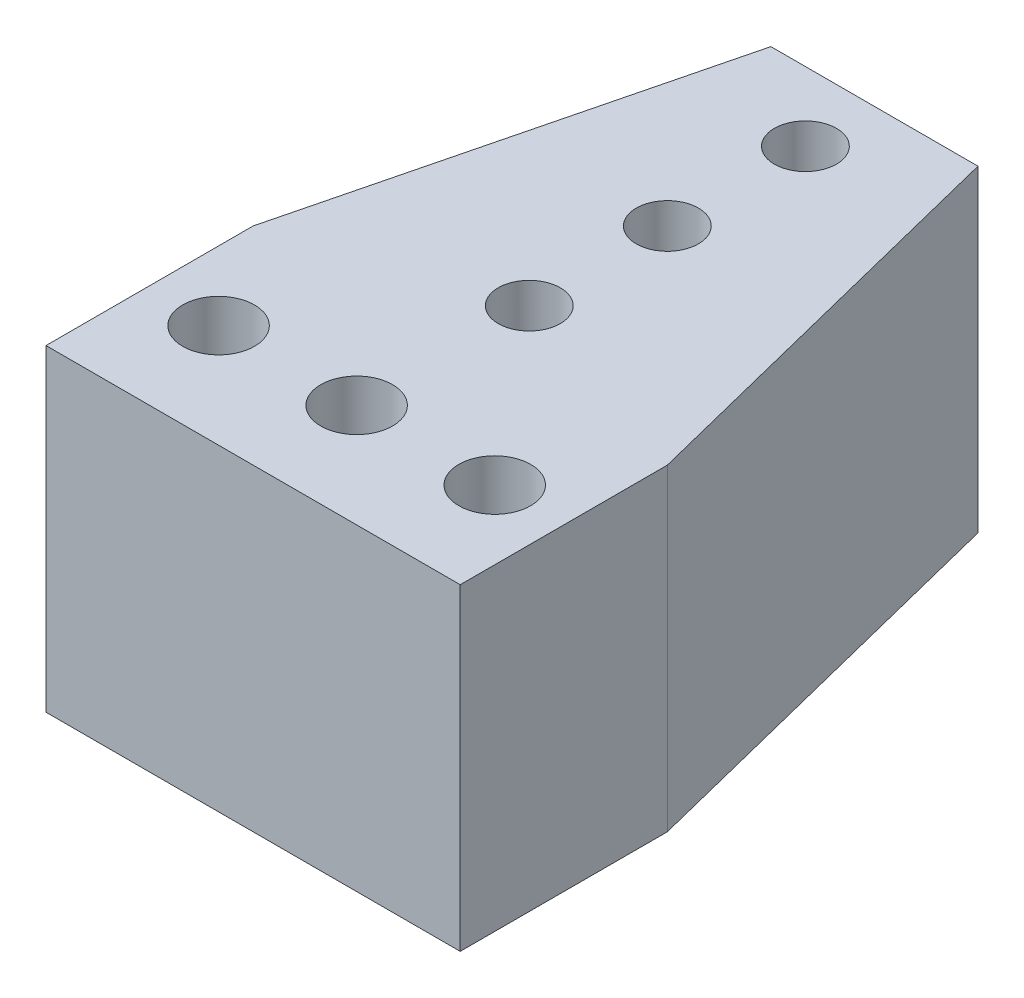
from build123d import *

# Parameters (mm, degrees)
SKETCH1_W           = 30
SKETCH1_H           = 15
SKETCH1_R           = 2.6
BOSS_EXTRUDE1_DEPTH = 23
SKETCH2_W           = 15
SKETCH2_H           = 30
BOSS_EXTRUDE2_DEPTH = 23
SKETCH3_R           = 2.25
CUT_EXTRUDE1_DEPTH  = 47.478489648
BOSS_EXTRUDE3_DEPTH = 23


with BuildPart() as part:
    # Sketch1 → Boss-Extrude1 (new body)
    with BuildSketch(Plane(origin=(0, 0, 0), x_dir=(1, 0, 0), z_dir=(0, 1, 0))):
        Rectangle(SKETCH1_W, SKETCH1_H)
        with Locations(Location((0, 0, 0), (0, 0, 270))):
            Circle(SKETCH1_R, mode=Mode.SUBTRACT)
        with Locations(Location((10, 0, 0), (0, 0, 270))):
            Circle(SKETCH1_R, mode=Mode.SUBTRACT)
        with Locations(Location((-10, 0, 0), (0, 0, 270))):
            Circle(SKETCH1_R, mode=Mode.SUBTRACT)
    extrude(amount=BOSS_EXTRUDE1_DEPTH)

    # Sketch2 → Boss-Extrude2 (add)
    with BuildSketch(Plane(origin=(0, 23, 0), x_dir=(1, 0, 0), z_dir=(0, 1, 0))):
        with Locations((0, 22.5)):
            Rectangle(SKETCH2_W, SKETCH2_H)
    extrude(amount=-BOSS_EXTRUDE2_DEPTH)

    # Sketch3 → Cut-Extrude1 (cut, through all)
    with BuildSketch(Plane(origin=(0, 23, 0), x_dir=(1, 0, 0), z_dir=(0, 1, 0))):
        with Locations(Location((0, 32.5, 0), (0, 0, 270))):
            Circle(SKETCH3_R)
        with Locations(Location((0, 22.5, 0), (0, 0, 270))):
            Circle(SKETCH3_R)
        with Locations(Location((0, 12.5, 0), (0, 0, 270))):
            Circle(SKETCH3_R)
    extrude(amount=-CUT_EXTRUDE1_DEPTH, mode=Mode.SUBTRACT)

    # Sketch4 → Boss-Extrude3 (add)
    with BuildSketch(Plane(origin=(0, 23, 0), x_dir=(1, 0, 0), z_dir=(0, 1, 0))):
        Polygon((-7.5, 37.5), (-15, 7.5), (-7.5, 7.5), align=None)
        Polygon((7.5, 37.5), (7.5, 7.5), (15, 7.5), align=None)
    extrude(amount=-BOSS_EXTRUDE3_DEPTH)


solid = part.part
